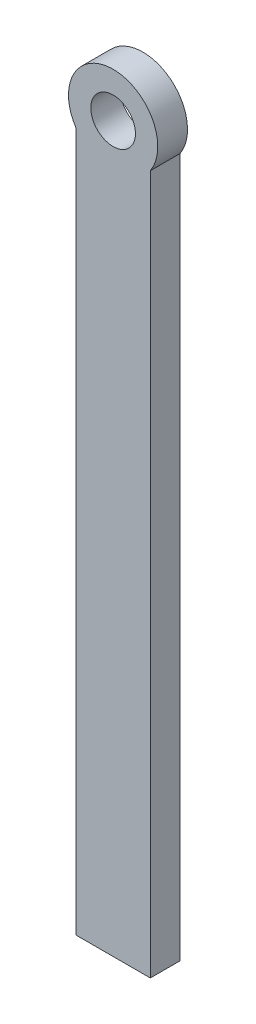
from build123d import *

# Parameters (mm, degrees)
SKETCH3_R           = 15
BOSS_EXTRUDE1_DEPTH = 20


with BuildPart() as part:
    # Sketch3 → Boss-Extrude1 (new body)
    with BuildSketch(Plane.XY):
        with BuildLine():
            Line((-25, -16.583123952), (-25, -486.583123952))
            Line((-25, -486.583123952), (25, -486.583123952))
            Line((25, -486.583123952), (25, -16.583123952))
            ThreePointArc((25, -16.583123952), (0, 30), (-25, -16.583123952))
        make_face()
        Circle(SKETCH3_R, mode=Mode.SUBTRACT)
    extrude(amount=BOSS_EXTRUDE1_DEPTH)


solid = part.part
